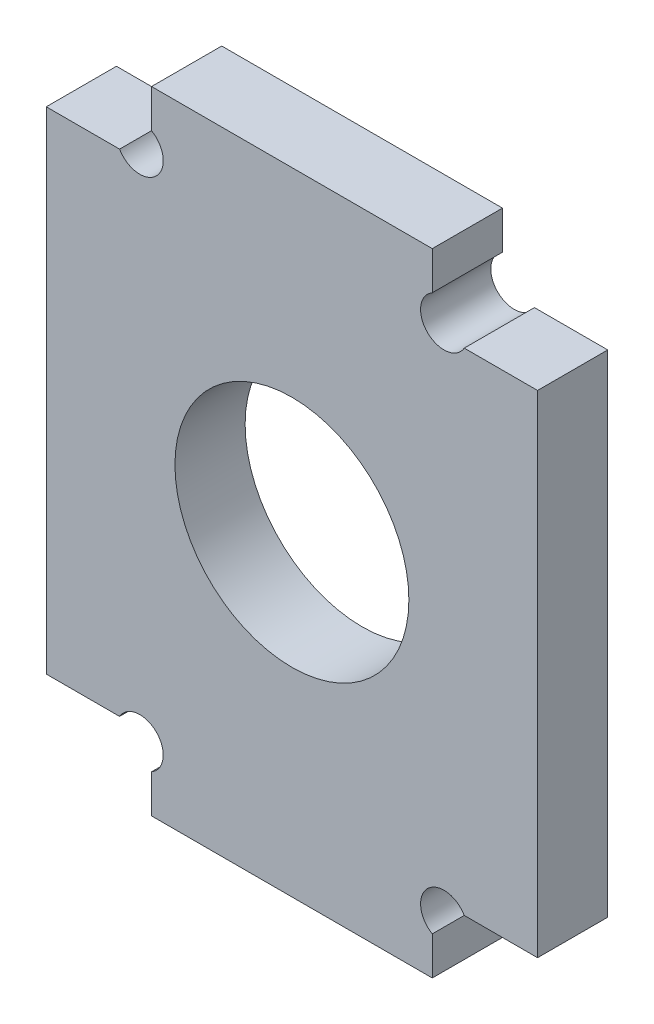
from build123d import *

# Parameters (mm, degrees)
SKETCH_1_W          = 12
SKETCH_1_H          = 3
SKETCH_1_H_2        = 21
SKETCH_1_W_2        = 4.5
EXTRUDE_1_DEPTH     = 3
SKETCH_2_R          = 5
CUT_EXTRUDE_1_DEPTH = 18.363755354
SKETCH_3_R          = 1
CUT_EXTRUDE_2_DEPTH = 18.363755354


with BuildPart() as part:
    # 草图1 → 凸台-拉伸1 (new body)
    with BuildSketch(Plane.XY):
        with Locations((0, 12)):
            Rectangle(SKETCH_1_W, SKETCH_1_H)
        Rectangle(SKETCH_1_W, SKETCH_1_H_2)
        with Locations((8.25, 0)):
            Rectangle(SKETCH_1_W_2, SKETCH_1_H_2)
        with Locations((0, -12)):
            Rectangle(SKETCH_1_W, SKETCH_1_H)
        with Locations((-8.25, 0)):
            Rectangle(SKETCH_1_W_2, SKETCH_1_H_2)
    extrude(amount=EXTRUDE_1_DEPTH)

    # 草图2 → 切除-拉伸1 (cut, through all)
    with BuildSketch(Plane.XY.offset(3)):
        Circle(SKETCH_2_R)
    extrude(amount=-CUT_EXTRUDE_1_DEPTH, mode=Mode.SUBTRACT)

    # 草图3 → 切除-拉伸2 (cut, through all)
    with BuildSketch(Plane.XY.offset(3)):
        with Locations((-6.5, 11)):
            Circle(SKETCH_3_R)
        with Locations((6.5, 11)):
            Circle(SKETCH_3_R)
        with Locations((6.5, -11)):
            Circle(SKETCH_3_R)
        with Locations((-6.5, -11)):
            Circle(SKETCH_3_R)
    extrude(amount=-CUT_EXTRUDE_2_DEPTH, mode=Mode.SUBTRACT)


solid = part.part
